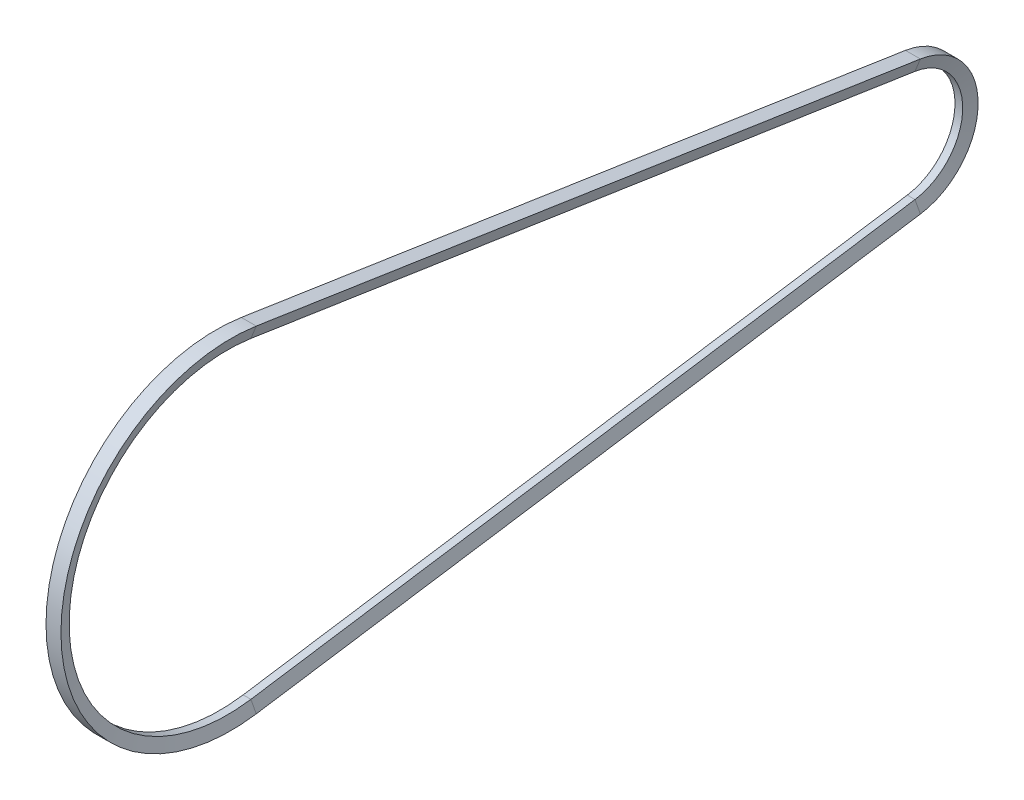
from build123d import *


with BuildPart() as part:
    # 扫描1: sweep along a path in 草图1
    with BuildLine(Plane(origin=(0, 0, 0), x_dir=(0, 0, -1), z_dir=(1, 0, 0))) as sweep_1_path:
        Line((18.75, 123.585749583), (507.5, 49.434299833))
        ThreePointArc((507.5, 49.434299833), (550, 0), (507.5, -49.434299833))
        Line((507.5, -49.434299833), (18.75, -123.585749583))
        ThreePointArc((18.75, -123.585749583), (-125, 0), (18.75, 123.585749583))
    # 草图2 → 扫描1 (sweep)
    with BuildSketch(Plane.XY):
        Polygon((-5.5, 125), (5.5, 125), (2.840143071, 116.3), (-2.840143071, 116.3), align=None)
    sweep(path=sweep_1_path.line)


solid = part.part
